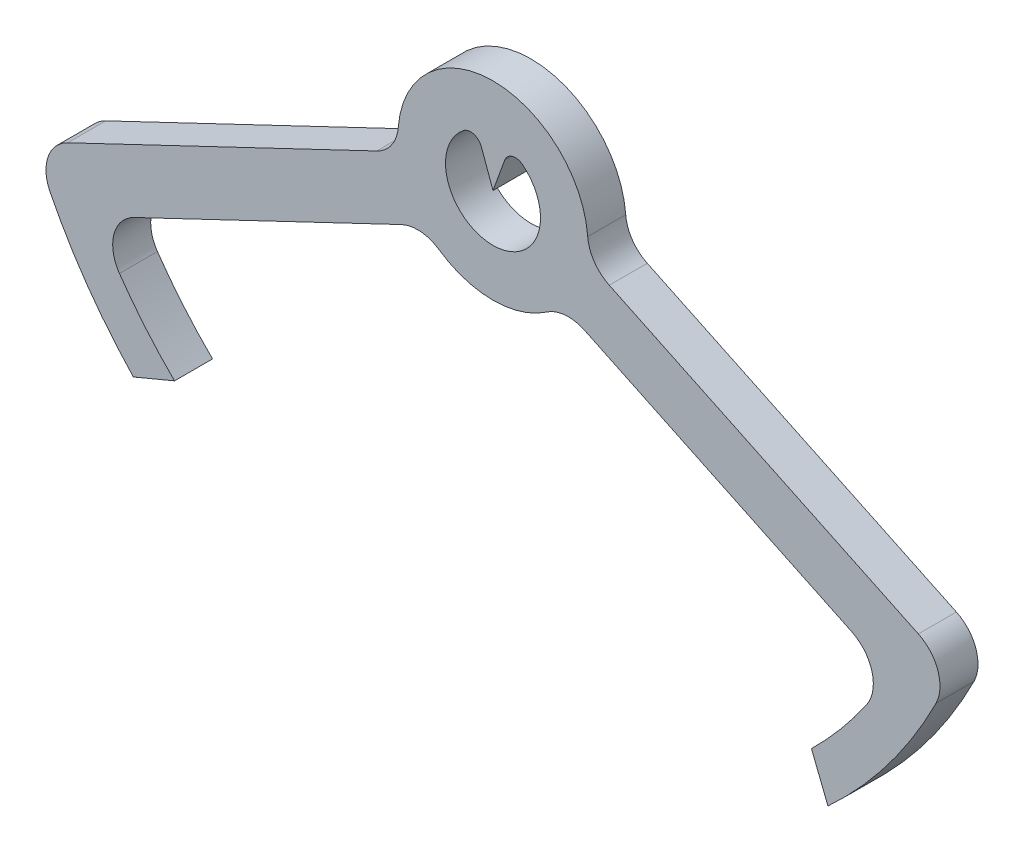
from build123d import *

# Parameters (mm, degrees)
BOSS_EXTRUDE1_DEPTH = 10
FILLET1_R           = 10
FILLET2_R           = 10
FILLET3_R           = 3


with BuildPart() as part:
    # Sketch1 → Boss-Extrude1 (new body)
    with BuildSketch(Plane.XY):
        with BuildLine():
            Line((-94.626197475, -89.797589363), (-83.792, -85.26796022))
            ThreePointArc((-83.792, -85.26796022), (-95.098975753, -72.442453815), (-104.460674711, -58.135116263))
            Line((-104.460674711, -58.135116263), (-18.296393823, -17.036489459))
            ThreePointArc((-18.296393823, -17.036489459), (0, -25), (18.296393823, -17.036489459))
            Line((18.296393823, -17.036489459), (104.460674711, -58.135116263))
            ThreePointArc((104.460674711, -58.135116263), (95.098975753, -72.442453815), (83.792, -85.26796022))
            Line((83.792, -85.26796022), (88.131779474, -96.179591135))
            ThreePointArc((88.131779474, -96.179591135), (107.052618298, -74.548381737), (120.777959535, -49.299176408))
            Line((120.777959535, -49.299176408), (24.754108024, -3.497732969))
            ThreePointArc((24.754108024, -3.497732969), (0, 25), (-24.754108024, -3.497732969))
            Line((-24.754108024, -3.497732969), (-120.777959535, -49.299176408))
            ThreePointArc((-120.777959535, -49.299176408), (-109.589087401, -70.766914774), (-94.626197475, -89.797589363))
        make_face()
        with BuildLine():
            Line((-4.275251792, 11.74615776), (0, 0))
            Line((0, 0), (4.275251792, 11.74615776))
            ThreePointArc((4.275251792, 11.74615776), (0, -12.5), (-4.275251792, 11.74615776))
        make_face(mode=Mode.SUBTRACT)
    extrude(amount=BOSS_EXTRUDE1_DEPTH)

    # Fillet1
    fillet1_edges = [part.edges().sort_by_distance(p)[0] for p in [
        (-18.296393823, -17.036489459, 5),
        (18.296393823, -17.036489459, 5),
        (24.754108024, -3.497732969, 5),
        (-24.754108024, -3.497732969, 5),
    ]]
    fillet(fillet1_edges, radius=FILLET1_R)

    # Fillet2
    fillet2_edges = [part.edges().sort_by_distance(p)[0] for p in [
        (120.777959535, -49.299176408, 5),
        (104.460674711, -58.135116263, 5),
        (-104.460674711, -58.135116263, 5),
        (-120.777959535, -49.299176408, 5),
    ]]
    fillet(fillet2_edges, radius=FILLET2_R)

    # Fillet3
    fillet3_edges = [part.edges().sort_by_distance(p)[0] for p in [
        (4.275251792, 11.74615776, 5),
        (-4.275251792, 11.74615776, 5),
    ]]
    fillet(fillet3_edges, radius=FILLET3_R)


solid = part.part
